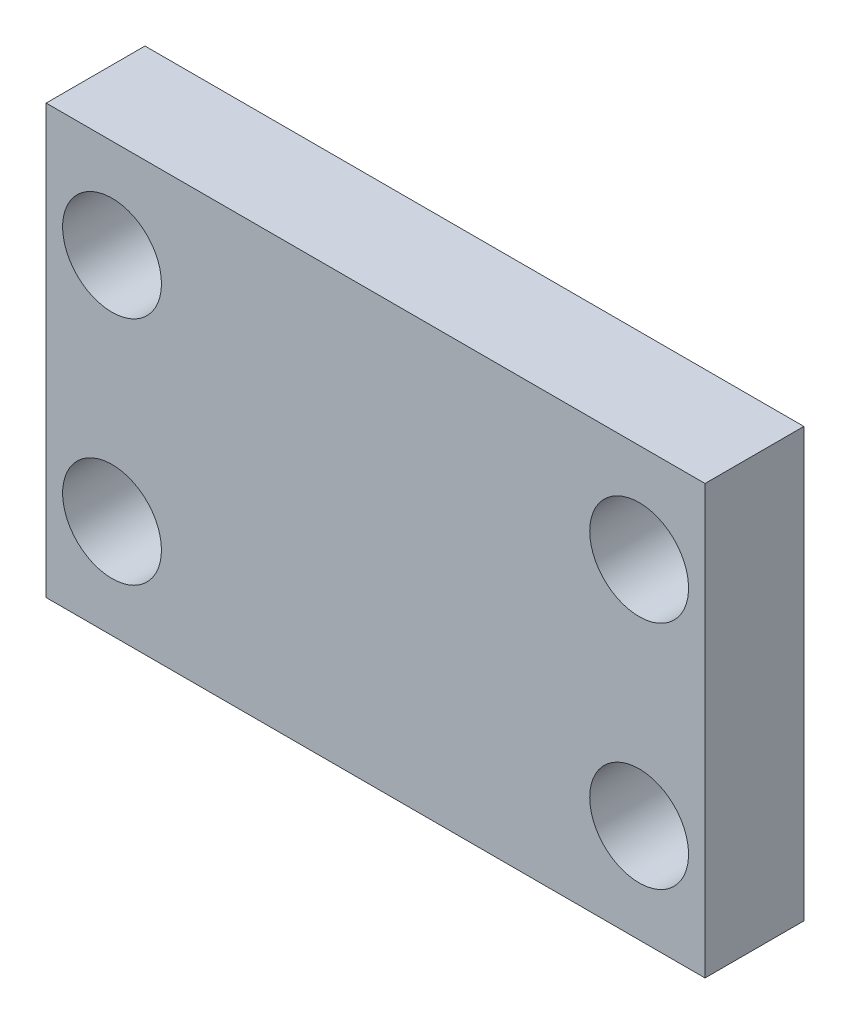
from build123d import *

# Parameters (mm, degrees)
SZKIC1_W                    = 20
SZKIC1_H                    = 13
SZKIC1_R                    = 1.5
DODANIE_WYCI_GNI_CIE1_DEPTH = 3


with BuildPart() as part:
    # Szkic1 → Dodanie-wyciągnięcie1 (new body)
    with BuildSketch(Plane.XY):
        Rectangle(SZKIC1_W, SZKIC1_H)
        with Locations((-8, 3.5)):
            Circle(SZKIC1_R, mode=Mode.SUBTRACT)
        with Locations((-8, -3.5)):
            Circle(SZKIC1_R, mode=Mode.SUBTRACT)
        with Locations(Location((8, 3.5, 0), (0, 0, 180))):
            Circle(SZKIC1_R, mode=Mode.SUBTRACT)
        with Locations(Location((8, -3.5, 0), (0, 0, 180))):
            Circle(SZKIC1_R, mode=Mode.SUBTRACT)
    extrude(amount=DODANIE_WYCI_GNI_CIE1_DEPTH)


solid = part.part
